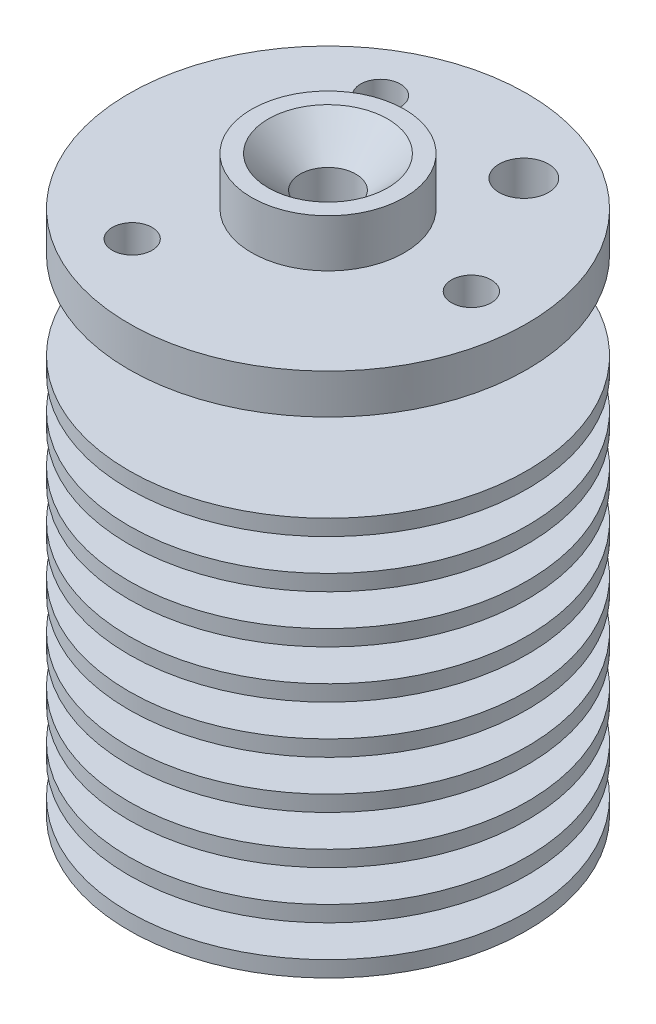
from build123d import *

# Parameters (mm, degrees)
LPATTERN1_COUNT       = 11
LPATTERN1_PITCH       = 3
CORTAR_EXTRUIR2_REACH = 35.113
CROQUIS2_R            = 12.499999999999996
CROQUIS2_R_2          = 3.4999999999999982
SKETCH3_R             = 4.8
BOSS_EXTRUDE1_DEPTH   = 3
SKETCH4_R             = 1.75
CUT_EXTRUDE1_DEPTH    = 41.10610926031096
CHAMFER1_SIZE         = 2
SKETCH7_R             = 12.499999999999996
SKETCH7_R_2           = 3.4999999999999982
CUT_EXTRUDE5_DEPTH    = 0.5
CUT_EXTRUDE2_REACH    = 39.437
SKETCH5_R             = 1.2499999999999991
SKETCH5_R_2           = 1.2500000000000002
BOSS_EXTRUDE2_REACH   = 41.211
SKETCH8_R             = 4.999999999999997
SKETCH8_R_2           = 3.4999999999999982
CORTAR_EXTRUIR1_REACH = 39.437
CROQUIS1_R            = 1.5500000000000003


with BuildPart() as part:
    # Sketch1 → Revolve1 (revolve)
    with BuildSketch(Plane.XY, mode=Mode.PRIVATE) as revolve1_sk:
        Polygon((-2.5, -3.1e-16), (-2.5, 5.999999999999998), (-0.7999999999999999, 5.999999999999998), (-0.8, 33), (-12.5, 33), (-12.499999999999995, 0), align=None)
    revolve(revolve1_sk.sketch.rotate(Axis((0, 0, 0), (0, 1, 0)), 270), axis=Axis((0, 0, 0), (0, 1, 0)))

    # Sketch2 → Cut-Revolve1 (revolve, cut)
    with BuildSketch(Plane(origin=(0, 0, 0), x_dir=(0, 0, -1), z_dir=(1, 0, 0))):
        Polygon((12.499999999999996, 30), (3.4999999999999973, 30), (3.499999999999998, 27.999999999999996), (12.499999999999996, 27.999999999999993), align=None)
    cut_revolve1 = revolve(axis=Axis((0, 33, 0), (0, -1, 0)), mode=Mode.SUBTRACT)

    # LPattern1: Cut-Revolve1 ×11
    with Locations(*[(0, -i * LPATTERN1_PITCH, 0) for i in range(1, LPATTERN1_COUNT)]):
        add(cut_revolve1, mode=Mode.SUBTRACT)

    # Croquis2 → Cortar-Extruir2 (cut, up to next)
    with BuildSketch(Plane(origin=(0, 27.999999999999996, 0), x_dir=(1, 0, 0), z_dir=(0, 1, 0)), mode=Mode.PRIVATE) as cortar_extruir2_sk1:
        with Locations(Location((0, 0, 0), (0, 0, 270))):
            Circle(CROQUIS2_R)
        with Locations(Location((0, 0, 0), (0, 0, 270))):
            Circle(CROQUIS2_R_2, mode=Mode.SUBTRACT)
    cortar_extruir2_tool1 = extrude(cortar_extruir2_sk1.sketch, amount=-CORTAR_EXTRUIR2_REACH, mode=Mode.PRIVATE) & part.part
    add(cortar_extruir2_tool1.solids().sort_by_distance((0, 28, -12.146447))[0], mode=Mode.SUBTRACT)

    # Sketch3 → Boss-Extrude1 (add)
    with BuildSketch(Plane(origin=(0, 33, 0), x_dir=(1, 0, 0), z_dir=(0, 1, 0))):
        with Locations(Location((0, 0, 0), (0, 0, 90))):
            Circle(SKETCH3_R)
    extrude(amount=BOSS_EXTRUDE1_DEPTH)

    # Sketch4 → Cut-Extrude1 (cut, through all)
    with BuildSketch(Plane(origin=(0, 36.00000000000001, 0), x_dir=(1, 0, 0), z_dir=(0, 1, 0))):
        with Locations(Location((0, 0, 0), (0, 0, 270))):
            Circle(SKETCH4_R)
    extrude(amount=-CUT_EXTRUDE1_DEPTH, mode=Mode.SUBTRACT)

    # Chamfer1
    chamfer1_edges = [part.edges().sort_by_distance(p)[0] for p in [
        (5.4e-16, 36.00000000000001, -1.75),
    ]]
    chamfer(chamfer1_edges, length=CHAMFER1_SIZE)

    # Sketch7 → Cut-Extrude5 (cut)
    with BuildSketch(Plane(origin=(0, 30, 0), x_dir=(1, 0, 0), z_dir=(0, 1, 0))):
        with Locations(Location((0, 0, 0), (0, 0, 270))):
            Circle(SKETCH7_R)
        with Locations(Location((0, 0, 0), (0, 0, 270))):
            Circle(SKETCH7_R_2, mode=Mode.SUBTRACT)
    extrude(amount=CUT_EXTRUDE5_DEPTH, mode=Mode.SUBTRACT)

    # Sketch5 → Cut-Extrude2 (cut, up to next)
    with BuildSketch(Plane(origin=(0, 33, 0), x_dir=(1, 0, 0), z_dir=(0, 1, 0)), mode=Mode.PRIVATE) as cut_extrude2_sk1:
        with Locations(Location((9, -9.8e-16, 0), (0, 0, 270))):
            Circle(SKETCH5_R)
    cut_extrude2_tool1 = extrude(cut_extrude2_sk1.sketch, amount=-CUT_EXTRUDE2_REACH, mode=Mode.PRIVATE) & part.part
    # Sketch5 → Cut-Extrude2 (cut, up to next)
    with BuildSketch(Plane(origin=(0, 33, 0), x_dir=(1, 0, 0), z_dir=(0, 1, 0)), mode=Mode.PRIVATE) as cut_extrude2_sk2:
        with Locations(Location((-4.499999999999999, -7.794228634059948, 0), (0, 0, 270))):
            Circle(SKETCH5_R_2)
    cut_extrude2_tool2 = extrude(cut_extrude2_sk2.sketch, amount=-CUT_EXTRUDE2_REACH, mode=Mode.PRIVATE) & part.part
    # Sketch5 → Cut-Extrude2 (cut, up to next)
    with BuildSketch(Plane(origin=(0, 33, 0), x_dir=(1, 0, 0), z_dir=(0, 1, 0)), mode=Mode.PRIVATE) as cut_extrude2_sk3:
        with Locations(Location((-4.5000000000000036, 7.794228634059946, 0), (0, 0, 270))):
            Circle(SKETCH5_R_2)
    cut_extrude2_tool3 = extrude(cut_extrude2_sk3.sketch, amount=-CUT_EXTRUDE2_REACH, mode=Mode.PRIVATE) & part.part
    add(cut_extrude2_tool1.solids().sort_by_distance((9, 33, 0))[0], mode=Mode.SUBTRACT)
    add(cut_extrude2_tool2.solids().sort_by_distance((-4.5, 33, 7.794229))[0], mode=Mode.SUBTRACT)
    add(cut_extrude2_tool3.solids().sort_by_distance((-4.5, 33, -7.794229))[0], mode=Mode.SUBTRACT)

    # Boss-Extrude2: up to this face of the body (flat: up to its plane)
    boss_extrude2_end = Plane(part.part.faces().sort_by_distance((0, 9, 12.146446609))[0])
    # Sketch8 → Boss-Extrude2 (add, up to the picked face)
    with BuildSketch(Plane(origin=(0, 0.9999999999999974, 0), x_dir=(1, 0, 0), z_dir=(0, 1, 0)), mode=Mode.PRIVATE) as boss_extrude2_sk1:
        with Locations(Location((0, 0, 0), (0, 0, 90))):
            Circle(SKETCH8_R)
        with Locations(Location((0, 0, 0), (0, 0, 270))):
            Circle(SKETCH8_R_2, mode=Mode.SUBTRACT)
    boss_extrude2_tool1 = split(extrude(boss_extrude2_sk1.sketch, amount=BOSS_EXTRUDE2_REACH, mode=Mode.PRIVATE), bisect_by=boss_extrude2_end, keep=Keep.BOTH, mode=Mode.PRIVATE)
    add(boss_extrude2_tool1.solids().sort_by(Axis((0, 1, 4.858579), (0, 1, 0)))[0])

    # Croquis1 → Cortar-Extruir1 (cut, up to next)
    with BuildSketch(Plane(origin=(0, 33, 0), x_dir=(1, 0, 0), z_dir=(0, 1, 0)), mode=Mode.PRIVATE) as cortar_extruir1_sk1:
        with Locations(Location((4.49999999999998, 7.7942286340599605, 0), (0, 0, 270))):
            Circle(CROQUIS1_R)
    cortar_extruir1_tool1 = extrude(cortar_extruir1_sk1.sketch, amount=-CORTAR_EXTRUIR1_REACH, mode=Mode.PRIVATE) & part.part
    add(cortar_extruir1_tool1.solids().sort_by_distance((4.5, 33, -7.794229))[0], mode=Mode.SUBTRACT)


solid = part.part
